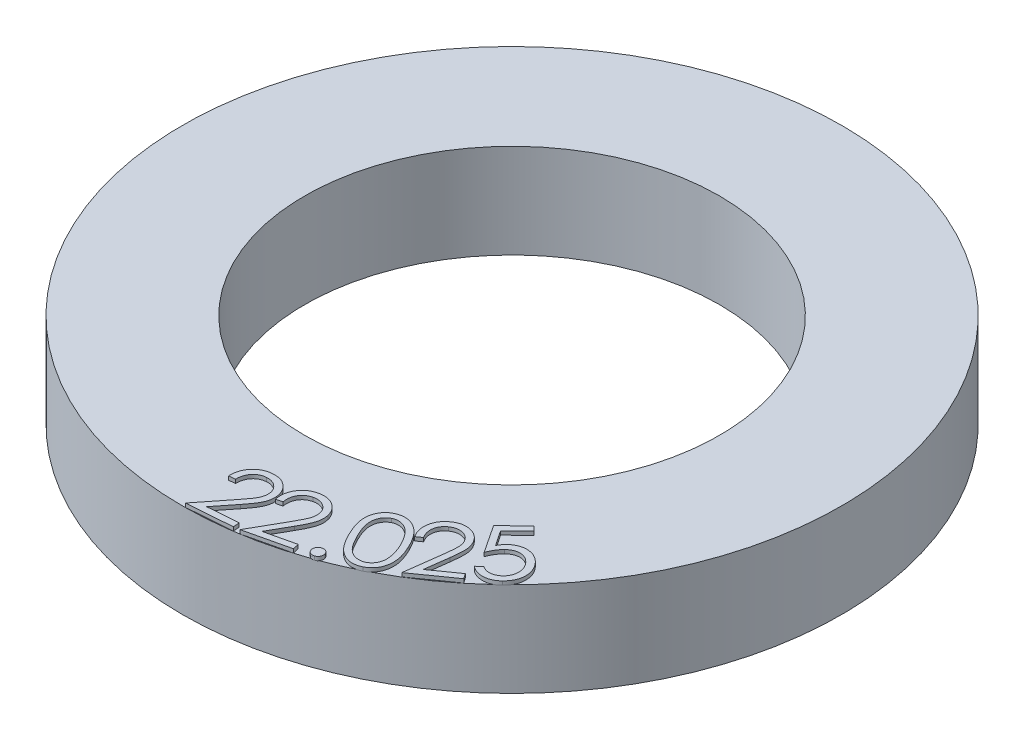
from build123d import *

# Parameters (mm, degrees)
SKETCH1_R           = 17.5
SKETCH1_R_2         = 11.0125
BOSS_EXTRUDE1_DEPTH = 5
BOSS_EXTRUDE2_DEPTH = 0.2


with BuildPart() as part:
    # Sketch1 → Boss-Extrude1 (new body)
    with BuildSketch(Plane(origin=(0, 0, 0), x_dir=(1, 0, 0), z_dir=(0, 1, 0))):
        Circle(SKETCH1_R)
        Circle(SKETCH1_R_2, mode=Mode.SUBTRACT)
    extrude(amount=BOSS_EXTRUDE1_DEPTH)

    # Sketch2 → Boss-Extrude2 (add)
    # profile 1 of 6: a face of its own
    with BuildSketch(Plane(origin=(0, 5, 0), x_dir=(1, 0, 0), z_dir=(0, 1, 0))):
        with BuildLine():
            Line((0.377203526, -15.06640625), (0.043469551, -15.092347756))
            add(Edge.make_bspline(
                [(0.043469551, -15.092347756), (0.042203297, -15.050032699), (0.039723419, -14.96716131), (0.049638285, -14.844981972), (0.067688405, -14.727624407), (0.098455755, -14.61556583), (0.138504263, -14.508522308), (0.188279293, -14.405930448), (0.249943807, -14.309195828), (0.320224245, -14.217586795), (0.399116148, -14.133937543), (0.484222111, -14.059456033), (0.574336923, -13.993992114), (0.671078969, -13.940092371), (0.773224869, -13.895612995), (0.881084602, -13.861423192), (0.994390789, -13.836174987), (1.072362547, -13.828578994), (1.111979167, -13.824719551)],
                knots=[0, 0, 0, 0, 1.099165856, 2.152647473, 3.179901334, 4.180092559, 5.165857059, 6.14623908, 7.136854445, 8.141313093, 9.142222958, 10.119044223, 11.076246807, 12.030555843, 12.990566437, 13.966122304, 14.966608418, 16, 16, 16, 16], degree=3))
            add(Edge.make_bspline(
                [(1.111979167, -13.824719551), (1.151232363, -13.822614291), (1.227892409, -13.818502795), (1.341072803, -13.824300473), (1.449209712, -13.840047194), (1.552456645, -13.867170925), (1.650809554, -13.903432336), (1.744251767, -13.950064736), (1.832189716, -14.007297288), (1.914237577, -14.07371881), (1.989801801, -14.146775331), (2.056191283, -14.225750107), (2.115236363, -14.307662186), (2.163673815, -14.394967734), (2.203994369, -14.485852699), (2.23381166, -14.581483532), (2.256306856, -14.680631266), (2.263224051, -14.74868976), (2.266726763, -14.783153045)],
                knots=[0, 0, 0, 0, 1.125255338, 2.197582177, 3.23984224, 4.249678898, 5.249348258, 6.237204937, 7.234226399, 8.248247252, 9.256507582, 10.239567543, 11.199778339, 12.143800945, 13.093950023, 14.042329097, 15.008679649, 16, 16, 16, 16], degree=3))
            add(Edge.make_bspline(
                [(2.266726763, -14.783153045), (2.268653871, -14.83201524), (2.272472697, -14.928842275), (2.256591946, -15.073272294), (2.221554197, -15.213909987), (2.177756368, -15.329043673), (2.13210079, -15.422970742), (2.088829613, -15.499650514), (2.039151976, -15.583479859), (1.980752569, -15.67318269), (1.913642882, -15.76882397), (1.840613729, -15.872212721), (1.757921696, -15.980725817), (1.700055339, -16.055042687), (1.670072115, -16.093549679)],
                knots=[0, 0, 0, 0, 1.190284496, 2.358709392, 3.525773572, 4.713480732, 5.352743619, 6.06901355, 6.858115264, 7.726847504, 8.676217017, 9.704931629, 10.810819393, 12, 12, 12, 12], degree=3))
            Line((1.670072115, -16.093549679), (0.875701122, -17.094751603))
            Line((0.875701122, -17.094751603), (2.482672276, -16.971354167))
            Line((2.482672276, -16.971354167), (2.508613782, -17.307191506))
            Line((2.508613782, -17.307191506), (0.14443109, -17.488782051))
            Line((0.14443109, -17.488782051), (1.363681891, -15.949819712))
            add(Edge.make_bspline(
                [(1.363681891, -15.949819712), (1.393527022, -15.912554926), (1.450782044, -15.841066007), (1.530584566, -15.73612355), (1.602999147, -15.639675593), (1.666852925, -15.550639363), (1.722438282, -15.469396851), (1.76961629, -15.395481899), (1.809021619, -15.329602995), (1.849329165, -15.251857602), (1.888211722, -15.159145837), (1.917541309, -15.046099013), (1.933704742, -14.93175562), (1.93042781, -14.855174346), (1.928786058, -14.816806891)],
                knots=[0, 0, 0, 0, 1.323859622, 2.539697786, 3.655679983, 4.668207506, 5.577749991, 6.384956845, 7.099630202, 7.705429782, 8.812646299, 9.878423536, 10.93708365, 12, 12, 12, 12], degree=3))
            add(Edge.make_bspline(
                [(1.928786058, -14.816806891), (1.92620974, -14.792668697), (1.921140936, -14.745177743), (1.905685163, -14.675960851), (1.882668381, -14.610204079), (1.854314913, -14.54686504), (1.818130268, -14.487171166), (1.775716227, -14.430480301), (1.726271651, -14.377301953), (1.671340099, -14.327125852), (1.611934069, -14.281949704), (1.548780398, -14.24375581), (1.483443961, -14.212316408), (1.415907726, -14.186368957), (1.345139571, -14.169292508), (1.271999298, -14.157876025), (1.196114655, -14.153502913), (1.144924611, -14.156323447), (1.118990385, -14.157752404)],
                knots=[0, 0, 0, 0, 1.002985613, 1.973335034, 2.923515741, 3.878986154, 4.836651989, 5.802759845, 6.800988188, 7.833639541, 8.87511098, 9.880838076, 10.878972912, 11.86950441, 12.865345595, 13.881918786, 14.926924211, 16, 16, 16, 16], degree=3))
            add(Edge.make_bspline(
                [(1.118990385, -14.157752404), (1.091811261, -14.160540619), (1.038491161, -14.166010548), (0.960749235, -14.182373159), (0.886899306, -14.205342141), (0.817246391, -14.235736869), (0.751710741, -14.272344942), (0.690146343, -14.315288584), (0.633132276, -14.365692478), (0.580060436, -14.422065975), (0.532383632, -14.484564259), (0.490634628, -14.552362028), (0.455698611, -14.625546395), (0.426899376, -14.703718722), (0.404472482, -14.787020099), (0.388336351, -14.875402791), (0.379467781, -14.969236984), (0.377971809, -15.033435801), (0.377203526, -15.06640625)],
                knots=[0, 0, 0, 0, 1.003856858, 1.969369873, 2.914991585, 3.842326504, 4.757764574, 5.67065914, 6.596081697, 7.550367434, 8.512664105, 9.480773, 10.472199548, 11.488843046, 12.539268398, 13.639696742, 14.787824085, 16, 16, 16, 16], degree=3))
        make_face()
    # profile 2 of 6: a face of its own
    with BuildSketch(Plane(origin=(0, 5, 0), x_dir=(1, 0, 0), z_dir=(0, 1, 0))):
        with BuildLine():
            Line((2.680077799, -14.84254585), (2.355458408, -14.918267004))
            add(Edge.make_bspline(
                [(2.355458408, -14.918267004), (2.347994142, -14.876767046), (2.333387531, -14.795556953), (2.323472579, -14.673990721), (2.324976016, -14.555728299), (2.336513827, -14.440605451), (2.359783356, -14.328975701), (2.394590343, -14.221092867), (2.439601661, -14.116379831), (2.494569659, -14.015576781), (2.559832485, -13.921863348), (2.631188548, -13.834656401), (2.710921768, -13.757361702), (2.797573287, -13.688946733), (2.891342116, -13.629703088), (2.992353062, -13.580084855), (3.099856127, -13.537971321), (3.175300136, -13.518303724), (3.213631485, -13.508311075)],
                knots=[0, 0, 0, 0, 1.100238416, 2.153025381, 3.178012026, 4.183884262, 5.168591255, 6.148695239, 7.138002634, 8.140019377, 9.140121407, 10.114951831, 11.077023251, 12.032670763, 12.99234068, 13.966349905, 14.966749606, 16, 16, 16, 16], degree=3))
            add(Edge.make_bspline(
                [(3.213631485, -13.508311075), (3.251843088, -13.50036415), (3.32664053, -13.484808413), (3.438897548, -13.473770246), (3.547813259, -13.472847982), (3.653615731, -13.482442125), (3.755983303, -13.503477882), (3.854414489, -13.536291351), (3.950096274, -13.578421826), (4.040814221, -13.631584861), (4.126003653, -13.692404589), (4.204208412, -13.758970295), (4.274030899, -13.831494589), (4.335160407, -13.90960072), (4.388361962, -13.993145467), (4.432982751, -14.082231672), (4.470178835, -14.176708828), (4.487307474, -14.242643219), (4.495983248, -14.27603944)],
                knots=[0, 0, 0, 0, 1.121990491, 2.196244399, 3.238232453, 4.250969426, 5.246356061, 6.236987075, 7.230101134, 8.248200839, 9.255501669, 10.237657177, 11.19803806, 12.146105858, 13.086011545, 14.042029985, 15.008274769, 16, 16, 16, 16], degree=3))
            add(Edge.make_bspline(
                [(4.495983248, -14.27603944), (4.505415824, -14.323774993), (4.524110077, -14.41838123), (4.529985585, -14.56283772), (4.516844757, -14.706380405), (4.49162199, -14.826395359), (4.460506924, -14.925374116), (4.431085731, -15.007919873), (4.393488718, -15.097141834), (4.349829317, -15.194418504), (4.299347185, -15.299042154), (4.242538162, -15.411720311), (4.177915647, -15.531101044), (4.131979942, -15.612908193), (4.108262895, -15.655146011)],
                knots=[0, 0, 0, 0, 1.190223456, 2.358882579, 3.52524119, 4.712819824, 5.35365978, 6.065105631, 6.857984567, 7.723828008, 8.67607557, 9.702436758, 10.813745988, 12, 12, 12, 12], degree=3))
            Line((4.108262895, -15.655146011), (3.479356645, -16.761516203))
            Line((3.479356645, -16.761516203), (5.041456004, -16.394829504))
            Line((5.041456004, -16.394829504), (5.11787828, -16.721552261))
            Line((5.11787828, -16.721552261), (2.819601036, -17.260714921))
            Line((2.819601036, -17.260714921), (3.785045748, -15.56119569))
            add(Edge.make_bspline(
                [(3.785045748, -15.56119569), (3.808529371, -15.519892567), (3.8536226, -15.440582352), (3.91665988, -15.325551236), (3.973290102, -15.219474376), (4.021957514, -15.121779814), (4.064311127, -15.032979861), (4.100364837, -14.953571722), (4.128654637, -14.882434307), (4.156784414, -14.800101176), (4.179688984, -14.702577351), (4.192972915, -14.587024863), (4.189968714, -14.471889792), (4.175230987, -14.396958355), (4.167858248, -14.359472934)],
                knots=[0, 0, 0, 0, 1.322508168, 2.539478858, 3.65113322, 4.669382137, 5.577246142, 6.389686428, 7.096378664, 7.707362647, 8.810322298, 9.877140803, 10.938012216, 12, 12, 12, 12], degree=3))
            add(Edge.make_bspline(
                [(4.167858248, -14.359472934), (4.161829404, -14.336171476), (4.149935411, -14.290201239), (4.123387221, -14.224893717), (4.091995869, -14.16328915), (4.053584185, -14.106135055), (4.009399893, -14.052600205), (3.95860095, -14.003544562), (3.901957352, -13.958350343), (3.840235373, -13.917568468), (3.775029978, -13.881814057), (3.707248163, -13.853637752), (3.637912338, -13.832678602), (3.56741324, -13.817301491), (3.494890393, -13.811664684), (3.421495235, -13.811468351), (3.346244991, -13.818247864), (3.296509601, -13.82889709), (3.271123472, -13.834332709)],
                knots=[0, 0, 0, 0, 0.998805992, 1.97049261, 2.921394182, 3.866479787, 4.824835265, 5.799717433, 6.794315519, 7.830951375, 8.869177059, 9.878822869, 10.873799922, 11.875291578, 12.869368348, 13.888722291, 14.922353531, 16, 16, 16, 16], degree=3))
            add(Edge.make_bspline(
                [(3.271123472, -13.834332709), (3.244792519, -13.841064204), (3.193002937, -13.854304184), (3.119061623, -13.882705923), (3.050115946, -13.91714881), (2.986034959, -13.957311139), (2.926579811, -14.002814596), (2.87305675, -14.05555418), (2.823928987, -14.113545846), (2.780414933, -14.177443519), (2.743380272, -14.246402199), (2.712244756, -14.319205359), (2.689061885, -14.396615139), (2.673136557, -14.477873433), (2.664009273, -14.563501926), (2.662180891, -14.653056839), (2.666949138, -14.746824786), (2.675629023, -14.810109822), (2.680077799, -14.84254585)],
                knots=[0, 0, 0, 0, 1.001857296, 1.97052376, 2.915105733, 3.840812044, 4.756468097, 5.670946457, 6.606992161, 7.556283339, 8.516782409, 9.490308786, 10.47212129, 11.491627338, 12.540773751, 13.644567144, 14.792749573, 16, 16, 16, 16], degree=3))
        make_face()
    # profile 3 of 6: a face of its own
    with BuildSketch(Plane(origin=(0, 5, 0), x_dir=(1, 0, 0), z_dir=(0, 1, 0))):
        with BuildLine():
            add(Edge.make_bspline(
                [(5.812610444, -15.938128556), (5.831374417, -15.932374898), (5.868100028, -15.921113607), (5.925587729, -15.918820778), (5.982023209, -15.927326543), (6.036365652, -15.947186897), (6.086750753, -15.976062519), (6.129683552, -16.014781695), (6.164195697, -16.061839206), (6.179302393, -16.097844445), (6.187009483, -16.116213491)],
                knots=[0, 0, 0, 0, 1.018533362, 1.993514881, 2.966138152, 3.9748784, 4.989476654, 5.972026843, 6.965374611, 8, 8, 8, 8], degree=3))
            add(Edge.make_bspline(
                [(6.187009483, -16.116213491), (6.192680674, -16.134982532), (6.203852009, -16.171954526), (6.207259114, -16.229869607), (6.198423544, -16.286997519), (6.178873974, -16.341926891), (6.149719297, -16.392227049), (6.111823907, -16.435344643), (6.065578658, -16.469979456), (6.029886494, -16.484584723), (6.011729034, -16.492014773)],
                knots=[0, 0, 0, 0, 1.018247088, 2.005783202, 2.990165439, 4.010083513, 5.024396598, 5.998572224, 6.981825626, 8, 8, 8, 8], degree=3))
            add(Edge.make_bspline(
                [(6.011729034, -16.492014773), (5.992964701, -16.497770106), (5.956238387, -16.509034678), (5.898755786, -16.511303732), (5.842003107, -16.502843983), (5.787364663, -16.482393394), (5.737095106, -16.452595757), (5.694096527, -16.414271405), (5.660232144, -16.367416245), (5.645083379, -16.332037335), (5.637329996, -16.313929838)],
                knots=[0, 0, 0, 0, 1.019327242, 1.995068695, 2.968450063, 3.99358383, 5.015165017, 5.99848104, 6.975590248, 8, 8, 8, 8], degree=3))
            add(Edge.make_bspline(
                [(5.637329996, -16.313929838), (5.63125142, -16.294941947), (5.619366426, -16.257816312), (5.617673921, -16.1996281), (5.624612676, -16.142442807), (5.645777227, -16.087974496), (5.675371175, -16.038150206), (5.712952105, -15.994657098), (5.759716127, -15.961248414), (5.794765915, -15.945928316), (5.812610444, -15.938128556)],
                knots=[0, 0, 0, 0, 1.033330105, 2.02039479, 3.003248301, 4.016090021, 5.036799157, 6.01117572, 6.98745084, 8, 8, 8, 8], degree=3))
        make_face()
    # profile 4 of 6: a face of its own
    with BuildSketch(Plane(origin=(0, 5, 0), x_dir=(1, 0, 0), z_dir=(0, 1, 0))):
        with BuildLine():
            add(Edge.make_bspline(
                [(5.926947455, -14.591409929), (5.902562604, -14.54107518), (5.85522936, -14.443370795), (5.79150997, -14.298815349), (5.73552527, -14.161061187), (5.68880451, -14.029731846), (5.649785175, -13.905181613), (5.619188564, -13.787581207), (5.598248206, -13.676253217), (5.584287385, -13.571155334), (5.57919627, -13.47108959), (5.578665054, -13.375088526), (5.585236468, -13.282599638), (5.596759429, -13.193244945), (5.615243522, -13.107554057), (5.638984629, -13.024937828), (5.669080659, -12.945939741), (5.705037952, -12.870486318), (5.746241388, -12.799320862), (5.792128244, -12.732441223), (5.841764309, -12.669637867), (5.896918, -12.611949163), (5.956348177, -12.558875199), (6.020054728, -12.510092605), (6.08799113, -12.46547704), (6.13657505, -12.440412141), (6.161122135, -12.42774807)],
                knots=[0, 0, 0, 0, 1.645123066, 3.193335451, 4.646111031, 6.018177867, 7.292391992, 8.484572827, 9.590181928, 10.622806741, 11.60056216, 12.535521377, 13.445088631, 14.32596282, 15.183511051, 16.021124921, 16.852309999, 17.667186738, 18.477264483, 19.268601895, 20.051291864, 20.829318415, 21.613184976, 22.392819618, 23.187970152, 24, 24, 24, 24], degree=3))
            add(Edge.make_bspline(
                [(6.161122135, -12.42774807), (6.186416897, -12.41586994), (6.236684693, -12.392264759), (6.314501335, -12.36470959), (6.393107517, -12.342410836), (6.472661692, -12.327239889), (6.553271877, -12.31802542), (6.634653285, -12.314965493), (6.716867714, -12.319760089), (6.799919287, -12.329168963), (6.883174943, -12.34608104), (6.966155539, -12.37003131), (7.048434116, -12.401004867), (7.130041398, -12.439298027), (7.211645957, -12.48399607), (7.291888095, -12.537079899), (7.372445514, -12.595899887), (7.451524623, -12.663226038), (7.53177806, -12.737252896), (7.608868058, -12.82306367), (7.687194006, -12.916651425), (7.763230912, -13.021265261), (7.839890412, -13.134520908), (7.914580255, -13.258417499), (7.989117127, -13.391622555), (8.036262527, -13.484859722), (8.060461077, -13.532716019)],
                knots=[0, 0, 0, 0, 0.815522942, 1.620673105, 2.407127251, 3.199421702, 3.982404283, 4.774463597, 5.573925633, 6.384810166, 7.21322184, 8.051218599, 8.904223805, 9.7773812, 10.681457269, 11.618366128, 12.584685123, 13.592104133, 14.649390235, 15.769905354, 16.957308209, 18.211614585, 19.544051311, 20.949621683, 22.434317369, 24, 24, 24, 24], degree=3))
            add(Edge.make_bspline(
                [(8.060461077, -13.532716019), (8.083676138, -13.580713633), (8.128993329, -13.674407851), (8.189986589, -13.813715623), (8.242569299, -13.947824566), (8.287954881, -14.076234074), (8.324531496, -14.199551885), (8.352671313, -14.31777949), (8.373480479, -14.430525051), (8.385322509, -14.538568758), (8.390320998, -14.641835648), (8.388887915, -14.741112208), (8.381864174, -14.836623314), (8.369763594, -14.928867051), (8.349831198, -15.017102648), (8.32452604, -15.101672159), (8.293824693, -15.182756182), (8.256422815, -15.259593676), (8.214636304, -15.33273874), (8.167170913, -15.400767195), (8.116455338, -15.464808393), (8.060066422, -15.523313135), (8.000349089, -15.578371457), (7.93440333, -15.627080401), (7.865231211, -15.672537356), (7.816007071, -15.698189525), (7.791230308, -15.711101436)],
                knots=[0, 0, 0, 0, 1.558232882, 3.041763995, 4.443401513, 5.767654612, 7.021227995, 8.200860323, 9.318297212, 10.369822129, 11.375069383, 12.33829166, 13.269771564, 14.172997789, 15.054657955, 15.910430237, 16.751491526, 17.585533636, 18.405670074, 19.210937023, 20.007816759, 20.79051811, 21.583582897, 22.378674821, 23.183912799, 24, 24, 24, 24], degree=3))
            add(Edge.make_bspline(
                [(7.791230308, -15.711101436), (7.766431263, -15.723049141), (7.717237552, -15.746749729), (7.640310472, -15.773330086), (7.563501911, -15.795698202), (7.485255082, -15.810196549), (7.406564328, -15.819379889), (7.326812105, -15.822494414), (7.246466062, -15.817645125), (7.165277192, -15.808308799), (7.084054508, -15.791536491), (7.003686605, -15.76703736), (6.923501898, -15.737517425), (6.844908293, -15.698666716), (6.766125548, -15.654780159), (6.688246546, -15.603267844), (6.611014094, -15.544912142), (6.534220148, -15.479151896), (6.456832329, -15.405441295), (6.381864903, -15.319672676), (6.304752618, -15.225276524), (6.229634456, -15.118649086), (6.153134594, -15.002369804), (6.076551088, -14.875315765), (6.001358636, -14.737010675), (5.952205998, -14.640833451), (5.926947455, -14.591409929)],
                knots=[0, 0, 0, 0, 0.809697074, 1.60619104, 2.392486736, 3.162970989, 3.945555516, 4.723499003, 5.508921287, 6.312809801, 7.127809543, 7.946286757, 8.784564208, 9.640029567, 10.524148465, 11.438198645, 12.386286821, 13.372094412, 14.413385884, 15.529264195, 16.723043957, 18.000326053, 19.366637222, 20.82031953, 22.366026776, 24, 24, 24, 24], degree=3))
        make_face()
        with BuildLine():
            add(Edge.make_bspline(
                [(6.22562534, -14.45118557), (6.247152486, -14.493827643), (6.288803655, -14.576332411), (6.35272169, -14.694479999), (6.415628804, -14.802963612), (6.477380889, -14.902249227), (6.538074292, -14.992095397), (6.598302452, -15.072064949), (6.657300152, -15.142495557), (6.715154253, -15.20428425), (6.773356993, -15.258295423), (6.832211594, -15.305661688), (6.891283645, -15.348442721), (6.951848821, -15.38466198), (7.01274857, -15.416545018), (7.074663848, -15.442555872), (7.137258339, -15.463081318), (7.220515336, -15.482234019), (7.323218316, -15.494762827), (7.443001609, -15.490442581), (7.557614302, -15.469311729), (7.627402949, -15.438375811), (7.662223898, -15.422940378)],
                knots=[0, 0, 0, 0, 1.478025749, 2.859714887, 4.155866294, 5.357813273, 6.477029825, 7.509705812, 8.454142307, 9.318703752, 10.127220785, 10.908768663, 11.655271175, 12.382037597, 13.090364968, 13.780707852, 14.457625429, 15.125951693, 16.422103099, 17.645012841, 18.824982443, 20, 20, 20, 20], degree=3))
            add(Edge.make_bspline(
                [(7.662223898, -15.422940378), (7.695666028, -15.404167702), (7.762262313, -15.366784004), (7.849830918, -15.290711031), (7.923556971, -15.19859189), (7.975453415, -15.111638599), (8.009498706, -15.035307025), (8.030955763, -14.973978081), (8.045692424, -14.909427994), (8.057351835, -14.842303984), (8.063428775, -14.772191044), (8.064728732, -14.699121437), (8.061335756, -14.623220526), (8.055185686, -14.571981636), (8.052047616, -14.545837013)],
                knots=[0, 0, 0, 0, 1.340731954, 2.669918642, 4.031505281, 5.459277207, 6.2031686, 6.956503628, 7.73084967, 8.519472747, 9.341382062, 10.192884166, 11.077919835, 12, 12, 12, 12], degree=3))
            add(Edge.make_bspline(
                [(8.052047616, -14.545837013), (8.047542123, -14.512816325), (8.038356813, -14.44549733), (8.016640203, -14.343855874), (7.990145068, -14.239492631), (7.957765528, -14.132843356), (7.919616276, -14.023950886), (7.876351819, -13.91243756), (7.826277247, -13.798749286), (7.78959367, -13.722843789), (7.770897776, -13.684158327)],
                knots=[0, 0, 0, 0, 0.87813012, 1.790236412, 2.737444307, 3.715690557, 4.726763541, 5.778019856, 6.867561238, 8, 8, 8, 8], degree=3))
            add(Edge.make_bspline(
                [(7.770897776, -13.684158327), (7.751495288, -13.645943616), (7.713480783, -13.571071088), (7.654007285, -13.463559032), (7.594322423, -13.362519752), (7.533558645, -13.269082417), (7.472338944, -13.182085344), (7.41031568, -13.102536152), (7.347516997, -13.02984651), (7.284739052, -12.96389037), (7.221094369, -12.904952382), (7.158429057, -12.851090127), (7.094461394, -12.805095916), (7.031004629, -12.764865341), (6.968161982, -12.729991873), (6.904313039, -12.702753809), (6.840990823, -12.680572129), (6.757483054, -12.661740495), (6.655825475, -12.649226099), (6.537337092, -12.652317621), (6.424111869, -12.674071923), (6.354886924, -12.704301144), (6.320276782, -12.719414737)],
                knots=[0, 0, 0, 0, 1.327514374, 2.600944907, 3.805270884, 4.961891585, 6.052582967, 7.099609732, 8.08508515, 9.027220953, 9.918472679, 10.771259012, 11.585082234, 12.356317507, 13.09818, 13.808277843, 14.504248721, 15.173304686, 16.456493135, 17.666030037, 18.833093612, 20, 20, 20, 20], degree=3))
            add(Edge.make_bspline(
                [(6.320276782, -12.719414737), (6.286741276, -12.738087308), (6.219690272, -12.775421308), (6.132990995, -12.853606532), (6.056973433, -12.945724965), (6.005166709, -13.034477487), (5.970770692, -13.111929614), (5.949945228, -13.174009348), (5.933000712, -13.238371264), (5.921010975, -13.305655266), (5.914160476, -13.375737952), (5.91203772, -13.448600845), (5.915302483, -13.524183102), (5.921847264, -13.603197497), (5.935722059, -13.687026049), (5.956180897, -13.776661244), (5.983906988, -13.872967535), (6.018289256, -13.975888076), (6.060009389, -14.085445407), (6.10837012, -14.201666646), (6.163943113, -14.32457598), (6.204611149, -14.408051619), (6.22562534, -14.45118557)],
                knots=[0, 0, 0, 0, 1.184359405, 2.368012177, 3.585550163, 4.869153856, 5.53289479, 6.205207044, 6.892746875, 7.590628501, 8.317360586, 9.069723882, 9.844008581, 10.657130917, 11.521409538, 12.470468649, 13.500510027, 14.621004524, 15.827064187, 17.127021726, 18.515460256, 20, 20, 20, 20], degree=3))
        make_face(mode=Mode.SUBTRACT)
    # profile 5 of 6: a face of its own
    with BuildSketch(Plane(origin=(0, 5, 0), x_dir=(1, 0, 0), z_dir=(0, 1, 0))):
        with BuildLine():
            Line((8.050451954, -12.754316345), (7.778416698, -12.946423717))
            add(Edge.make_bspline(
                [(7.778416698, -12.946423717), (7.75574982, -12.911071608), (7.711236137, -12.841646407), (7.657400837, -12.73213566), (7.614471669, -12.622110368), (7.582436796, -12.511152703), (7.561988666, -12.399113636), (7.552932152, -12.285912712), (7.554820027, -12.171722581), (7.569204713, -12.057910275), (7.593409527, -11.946382394), (7.62776704, -11.839210811), (7.672436867, -11.737666062), (7.725890768, -11.641112131), (7.79168322, -11.551877682), (7.865376088, -11.467017122), (7.949826615, -11.388142819), (8.012361399, -11.341448202), (8.044141858, -11.317717787)],
                knots=[0, 0, 0, 0, 1.095910755, 2.15217216, 3.180126126, 4.176880321, 5.163267028, 6.149049379, 7.137906323, 8.140157143, 9.13972864, 10.114396539, 11.073656743, 12.032781037, 12.989864371, 13.963002478, 14.964788651, 16, 16, 16, 16], degree=3))
            add(Edge.make_bspline(
                [(8.044141858, -11.317717787), (8.076472772, -11.295823523), (8.139898005, -11.252872407), (8.239602263, -11.200435781), (8.340159306, -11.159320127), (8.441509898, -11.128739377), (8.544029438, -11.109825824), (8.647456298, -11.101966441), (8.751596202, -11.105561252), (8.855601523, -11.120422057), (8.956988223, -11.145096031), (9.054630438, -11.176757121), (9.145718513, -11.219123476), (9.232893852, -11.266708516), (9.312822977, -11.325339494), (9.388367885, -11.390285486), (9.457612974, -11.464633547), (9.498524369, -11.519247649), (9.519302115, -11.546984614)],
                knots=[0, 0, 0, 0, 1.123413124, 2.203857893, 3.235853446, 4.246956373, 5.245898599, 6.230969123, 7.227279684, 8.239657717, 9.24977525, 10.228460745, 11.188962283, 12.137823534, 13.082621121, 14.036430835, 15.002758488, 16, 16, 16, 16], degree=3))
            add(Edge.make_bspline(
                [(9.519302115, -11.546984614), (9.546136241, -11.587705558), (9.599185969, -11.668208831), (9.658881509, -11.800157687), (9.702061595, -11.937869617), (9.722679402, -12.058885035), (9.732181386, -12.162185813), (9.734148543, -12.249728189), (9.734685561, -12.346541682), (9.729584649, -12.452882377), (9.723214718, -12.568900579), (9.71118776, -12.694325344), (9.697732364, -12.829303694), (9.685497933, -12.922148442), (9.679157884, -12.970261858)],
                knots=[0, 0, 0, 0, 1.192690377, 2.357889283, 3.532704618, 4.718274557, 5.356120917, 6.071885258, 6.861684818, 7.72656775, 8.678338785, 9.706873352, 10.81167048, 12, 12, 12, 12], degree=3))
            Line((9.679157884, -12.970261858), (9.512290897, -14.230878845))
            Line((9.512290897, -14.230878845), (10.821285288, -13.304696954))
            Line((10.821285288, -13.304696954), (11.015496025, -13.578835576))
            Line((11.015496025, -13.578835576), (9.089514454, -14.941816345))
            Line((9.089514454, -14.941816345), (9.344722788, -13.005317947))
            add(Edge.make_bspline(
                [(9.344722788, -13.005317947), (9.350876253, -12.958119344), (9.362688595, -12.86751576), (9.378466315, -12.736925142), (9.390139674, -12.617201917), (9.399637953, -12.508325237), (9.40541387, -12.410129646), (9.407505869, -12.322670012), (9.407018709, -12.24619548), (9.40284618, -12.159549845), (9.387983767, -12.060735698), (9.35662303, -11.949019827), (9.309914016, -11.84385806), (9.268689788, -11.779736732), (9.24796798, -11.747505447)],
                knots=[0, 0, 0, 0, 1.324853112, 2.543220171, 3.661061288, 4.672878806, 5.585066668, 6.398427791, 7.107504353, 7.713344522, 8.811787278, 9.880452689, 10.934586436, 12, 12, 12, 12], degree=3))
            add(Edge.make_bspline(
                [(9.24796798, -11.747505447), (9.233657583, -11.728231526), (9.205439981, -11.690226719), (9.156305176, -11.639664518), (9.103798852, -11.594377304), (9.046418065, -11.555725547), (8.985430881, -11.522711926), (8.920190146, -11.495616733), (8.850675878, -11.475851572), (8.778309459, -11.460808051), (8.704311792, -11.453588897), (8.630865103, -11.451618421), (8.558426348, -11.458031186), (8.487892712, -11.472366479), (8.41818143, -11.492610084), (8.350278879, -11.521041939), (8.283220962, -11.555981846), (8.240903361, -11.584427953), (8.219422307, -11.598867627)],
                knots=[0, 0, 0, 0, 0.995891806, 1.963724675, 2.920595791, 3.870799422, 4.83047179, 5.796502588, 6.797676676, 7.827373342, 8.86163348, 9.880849032, 10.874610586, 11.873854222, 12.865718377, 13.884009387, 14.92589116, 16, 16, 16, 16], degree=3))
            add(Edge.make_bspline(
                [(8.219422307, -11.598867627), (8.197589765, -11.615054748), (8.154752739, -11.646815049), (8.096961715, -11.700815823), (8.045494088, -11.757941208), (8.001952156, -11.819711245), (7.964339584, -11.884261253), (7.934384174, -11.952862894), (7.909880694, -12.024678442), (7.89445669, -12.10031943), (7.884819795, -12.177945688), (7.884534713, -12.257144815), (7.89140539, -12.337478617), (7.907111722, -12.419166672), (7.931153756, -12.501882181), (7.963168631, -12.585625545), (8.002095467, -12.670812788), (8.034085463, -12.726054154), (8.050451954, -12.754316345)],
                knots=[0, 0, 0, 0, 1.002821556, 1.9676084, 2.914987817, 3.836871811, 4.753084116, 5.668686655, 6.59648861, 7.549354221, 8.513755073, 9.480276974, 10.467796518, 11.486640661, 12.546326272, 13.644184179, 14.79473446, 16, 16, 16, 16], degree=3))
        make_face()
    # profile 6 of 6: a face of its own
    with BuildSketch(Plane(origin=(0, 5, 0), x_dir=(1, 0, 0), z_dir=(0, 1, 0))):
        with BuildLine():
            Line((10.452754524, -9.291042604), (10.68552696, -9.530826258))
            Line((10.68552696, -9.530826258), (9.789493306, -10.399516162))
            Line((9.789493306, -10.399516162), (10.327954844, -11.205105104))
            add(Edge.make_bspline(
                [(10.327954844, -11.205105104), (10.347405355, -11.172122652), (10.385204959, -11.108025431), (10.446885728, -11.0193262), (10.509702256, -10.939697419), (10.555405561, -10.893202352), (10.577554203, -10.870670008)],
                knots=[0, 0, 0, 0, 1.0972362, 2.132339663, 3.094898282, 4, 4, 4, 4], degree=3))
            add(Edge.make_bspline(
                [(10.577554203, -10.870670008), (10.606317416, -10.844200281), (10.662747921, -10.792269364), (10.753702799, -10.724629144), (10.848024177, -10.668009567), (10.945991502, -10.62309149), (11.04674006, -10.588531661), (11.150525188, -10.564262159), (11.257758966, -10.552017687), (11.36719103, -10.549746582), (11.476645925, -10.558902183), (11.583969895, -10.578635191), (11.688412673, -10.608797506), (11.789577002, -10.650442128), (11.88756755, -10.702847316), (11.982623387, -10.765422339), (12.074164549, -10.839462139), (12.130996143, -10.895414044), (12.159986094, -10.923955265)],
                knots=[0, 0, 0, 0, 1.056660519, 2.073060671, 3.059518756, 4.02677442, 4.98224816, 5.935943106, 6.903425925, 7.895980916, 8.891750929, 9.868685659, 10.842855965, 11.826495158, 12.821843791, 13.84390824, 14.900171671, 16, 16, 16, 16], degree=3))
            add(Edge.make_bspline(
                [(12.159986094, -10.923955265), (12.179371474, -10.944790443), (12.217879566, -10.986178488), (12.27122311, -11.051190736), (12.319127373, -11.119122899), (12.362370005, -11.188926824), (12.401443021, -11.260839418), (12.434751195, -11.335040663), (12.463945876, -11.411244998), (12.48736708, -11.489374708), (12.506429447, -11.568206729), (12.519773102, -11.646915148), (12.527677962, -11.725163122), (12.529442244, -11.802697072), (12.527212836, -11.879846664), (12.517429582, -11.956344907), (12.503941494, -12.032619884), (12.48378444, -12.107875306), (12.459677752, -12.18213013), (12.429283702, -12.254748742), (12.393111387, -12.325269634), (12.353457012, -12.395471186), (12.306878168, -12.462802716), (12.256204782, -12.529296219), (12.200270131, -12.593980231), (12.159104301, -12.634499511), (12.138251319, -12.655024976)],
                knots=[0, 0, 0, 0, 1.055652629, 2.097001478, 3.117016048, 4.137178009, 5.141932989, 6.150831921, 7.15243954, 8.167281964, 9.17461492, 10.159572065, 11.126698888, 12.089462946, 13.035170943, 13.986940597, 14.947789716, 15.906759268, 16.874624253, 17.842372723, 18.823391324, 19.813866479, 20.831113527, 21.857739712, 22.91481563, 24, 24, 24, 24], degree=3))
            add(Edge.make_bspline(
                [(12.138251319, -12.655024976), (12.112728931, -12.678884978), (12.062572626, -12.725774383), (11.981204616, -12.786743559), (11.897891282, -12.839563216), (11.81168422, -12.883702587), (11.722425767, -12.917787042), (11.630937819, -12.943862727), (11.536875372, -12.961812787), (11.440809295, -12.969665841), (11.344361381, -12.970104026), (11.249100137, -12.960666604), (11.15568141, -12.943230755), (11.064168704, -12.917126414), (10.974739633, -12.88265442), (10.887481161, -12.839323474), (10.801350171, -12.788490568), (10.74732779, -12.747875068), (10.719881928, -12.727240521)],
                knots=[0, 0, 0, 0, 1.074988754, 2.112555675, 3.124661908, 4.109336649, 5.08879237, 6.06132568, 7.03505602, 8.031750268, 9.024697533, 10.000552301, 10.974282641, 11.946815951, 12.926271671, 13.920599676, 14.943568705, 16, 16, 16, 16], degree=3))
            Line((10.719881928, -12.727240521), (10.977894748, -12.477641162))
            add(Edge.make_bspline(
                [(10.977894748, -12.477641162), (11.005569592, -12.495806132), (11.058958533, -12.530849094), (11.142274933, -12.571307457), (11.223303732, -12.601834409), (11.303835464, -12.619418621), (11.384206354, -12.626812892), (11.465592515, -12.622543133), (11.548546659, -12.610395006), (11.631541431, -12.586678649), (11.713315566, -12.555227199), (11.79003461, -12.513203013), (11.863081375, -12.465249111), (11.905744814, -12.425918472), (11.927213658, -12.406126739)],
                knots=[0, 0, 0, 0, 1.146609473, 2.21198236, 3.203991316, 4.141735567, 5.06091789, 5.993607636, 6.960785206, 7.9613937, 8.980047274, 9.991456537, 10.989272553, 12, 12, 12, 12], degree=3))
            add(Edge.make_bspline(
                [(11.927213658, -12.406126739), (11.947116828, -12.386005376), (11.986402209, -12.346289317), (12.035962279, -12.279596876), (12.078460887, -12.209980418), (12.112896717, -12.13660745), (12.140008149, -12.059672512), (12.157877371, -11.97865727), (12.168483663, -11.893913963), (12.170909111, -11.806404543), (12.166734501, -11.718027891), (12.151985482, -11.63131791), (12.130873661, -11.546673074), (12.099180165, -11.465112367), (12.060839275, -11.385488303), (12.013270909, -11.308543182), (11.957268088, -11.234236594), (11.914534234, -11.187928511), (11.892858691, -11.16444004)],
                knots=[0, 0, 0, 0, 0.981100706, 1.936521514, 2.875413226, 3.807837019, 4.744062615, 5.700309258, 6.681141738, 7.70357785, 8.73517306, 9.745864638, 10.751074282, 11.75729772, 12.776576466, 13.814275091, 14.891352574, 16, 16, 16, 16], degree=3))
            add(Edge.make_bspline(
                [(11.892858691, -11.16444004), (11.872137928, -11.144234653), (11.831654893, -11.104758529), (11.766668116, -11.052287247), (11.699295697, -11.008320363), (11.630215196, -10.970995498), (11.558251382, -10.94312445), (11.484493288, -10.922701854), (11.40860198, -10.909885054), (11.331322757, -10.905282683), (11.253452672, -10.907508432), (11.176677684, -10.919966679), (11.101316048, -10.939681012), (11.027016104, -10.966980311), (10.954630799, -11.003921394), (10.883856199, -11.049188603), (10.813827289, -11.101765043), (10.770241753, -11.142289868), (10.7479268, -11.163037797)],
                knots=[0, 0, 0, 0, 1.076879693, 2.103945646, 3.102811146, 4.067885311, 5.020966591, 5.968553643, 6.912420025, 7.879921856, 8.846132302, 9.805780904, 10.767910189, 11.742270505, 12.745972787, 13.786107055, 14.866529529, 16, 16, 16, 16], degree=3))
            add(Edge.make_bspline(
                [(10.7479268, -11.163037797), (10.72944525, -11.18196967), (10.691371943, -11.220970676), (10.637581559, -11.285710865), (10.585073113, -11.357609334), (10.533131962, -11.436086725), (10.482779483, -11.521834294), (10.43353593, -11.614646619), (10.386263425, -11.714834238), (10.356045618, -11.784382409), (10.340575037, -11.819988919)],
                knots=[0, 0, 0, 0, 0.816012069, 1.681042897, 2.593913321, 3.56181962, 4.583248113, 5.660561185, 6.802279776, 8, 8, 8, 8], degree=3))
            Line((10.340575037, -11.819988919), (9.363912376, -10.346230906))
            Line((9.363912376, -10.346230906), (10.452754524, -9.291042604))
        make_face()
    extrude(amount=BOSS_EXTRUDE2_DEPTH)


solid = part.part
